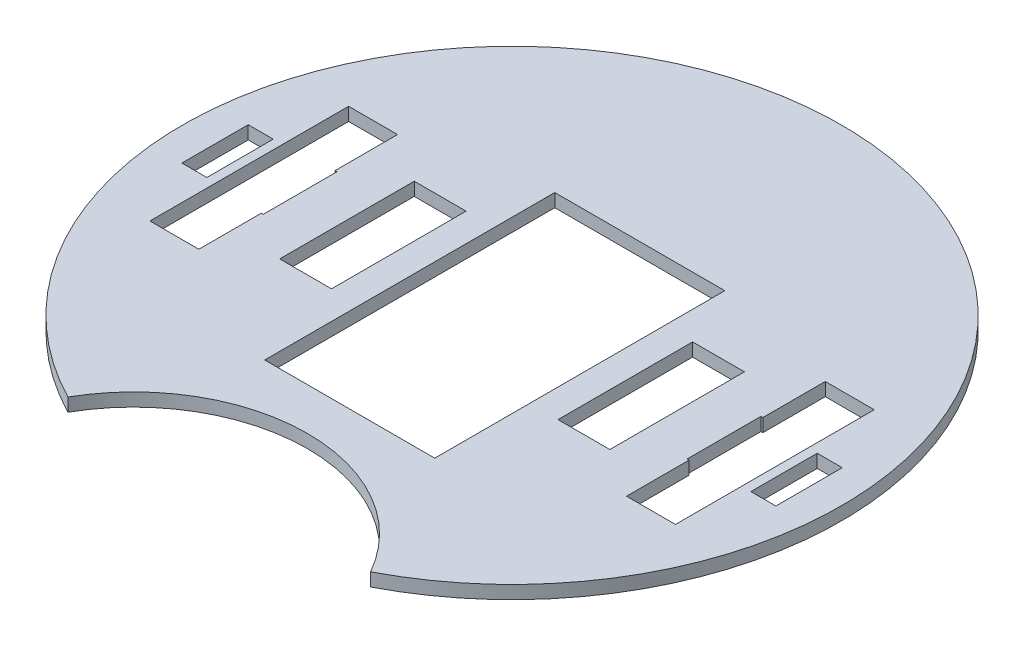
from build123d import *

# Parameters (mm, degrees)
BOSS_EXTRUDE1_DEPTH  = 2.9
SOLENOID_PLACEMENT_W = 37.4
SOLENOID_PLACEMENT_H = 63.8
CUT_EXTRUDE1_DEPTH   = 103.571487266
SKETCH2_W            = 10.76
SKETCH2_H            = 43.707605188
CUT_EXTRUDE2_DEPTH   = 103.571487266
SKETCH3_W            = 11.4
SKETCH3_H            = 29.6
CUT_EXTRUDE3_DEPTH   = 103.571487266
SKETCH5_W            = 5.5
SKETCH5_H            = 14.6
CUT_EXTRUDE4_DEPTH   = 103.571487266
SKETCH6_W            = 0.73
SKETCH6_H            = 16.225619988
CUT_EXTRUDE5_DEPTH   = 103.571487266


with BuildPart() as part:
    # Sketch1 → Boss-Extrude1 (new body)
    with BuildSketch(Plane(origin=(0, 0, 0), x_dir=(1, 0, 0), z_dir=(0, 1, 0))):
        with BuildLine():
            ThreePointArc((33.29110537, -64.404598464), (0, 72.5), (-33.29110537, -64.404598464))
            ThreePointArc((-33.29110537, -64.404598464), (0, -44.989799638), (33.29110537, -64.404598464))
        make_face()
    extrude(amount=BOSS_EXTRUDE1_DEPTH)

    # solenoid placement → Cut-Extrude1 (cut, through all)
    with BuildSketch(Plane(origin=(0, 2.9, 0), x_dir=(1, 0, 0), z_dir=(0, 1, 0))):
        with Locations((0, -3.8)):
            Rectangle(SOLENOID_PLACEMENT_W, SOLENOID_PLACEMENT_H)
    extrude(amount=-CUT_EXTRUDE1_DEPTH, mode=Mode.SUBTRACT)

    # Sketch2 → Cut-Extrude2 (cut, through all)
    with BuildSketch(Plane(origin=(0, 2.9, 0), x_dir=(1, 0, 0), z_dir=(0, 1, 0))):
        with Locations((52.42, 0)):
            Rectangle(SKETCH2_W, SKETCH2_H)
        with Locations((-52.42, 0)):
            Rectangle(SKETCH2_W, SKETCH2_H)
    extrude(amount=-CUT_EXTRUDE2_DEPTH, mode=Mode.SUBTRACT)

    # Sketch3 → Cut-Extrude3 (cut, through all)
    with BuildSketch(Plane(origin=(0, 2.9, 0), x_dir=(1, 0, 0), z_dir=(0, 1, 0))):
        with Locations((-30.61, 0)):
            Rectangle(SKETCH3_W, SKETCH3_H)
        with Locations((30.61, 0)):
            Rectangle(SKETCH3_W, SKETCH3_H)
    extrude(amount=-CUT_EXTRUDE3_DEPTH, mode=Mode.SUBTRACT)

    # Sketch5 → Cut-Extrude4 (cut, through all)
    with BuildSketch(Plane(origin=(0, 2.9, 0), x_dir=(1, 0, 0), z_dir=(0, 1, 0))):
        with Locations((-62.58, 0)):
            Rectangle(SKETCH5_W, SKETCH5_H)
        with Locations((62.58, 0)):
            Rectangle(SKETCH5_W, SKETCH5_H)
    extrude(amount=-CUT_EXTRUDE4_DEPTH, mode=Mode.SUBTRACT)

    # Sketch6 → Cut-Extrude5 (cut, through all)
    with BuildSketch(Plane(origin=(0, 2.9, 0), x_dir=(1, 0, 0), z_dir=(0, 1, 0))):
        with Locations((-46.975, 0)):
            Rectangle(SKETCH6_W, SKETCH6_H)
        with Locations((46.975, 0)):
            Rectangle(SKETCH6_W, SKETCH6_H)
    extrude(amount=-CUT_EXTRUDE5_DEPTH, mode=Mode.SUBTRACT)


solid = part.part
